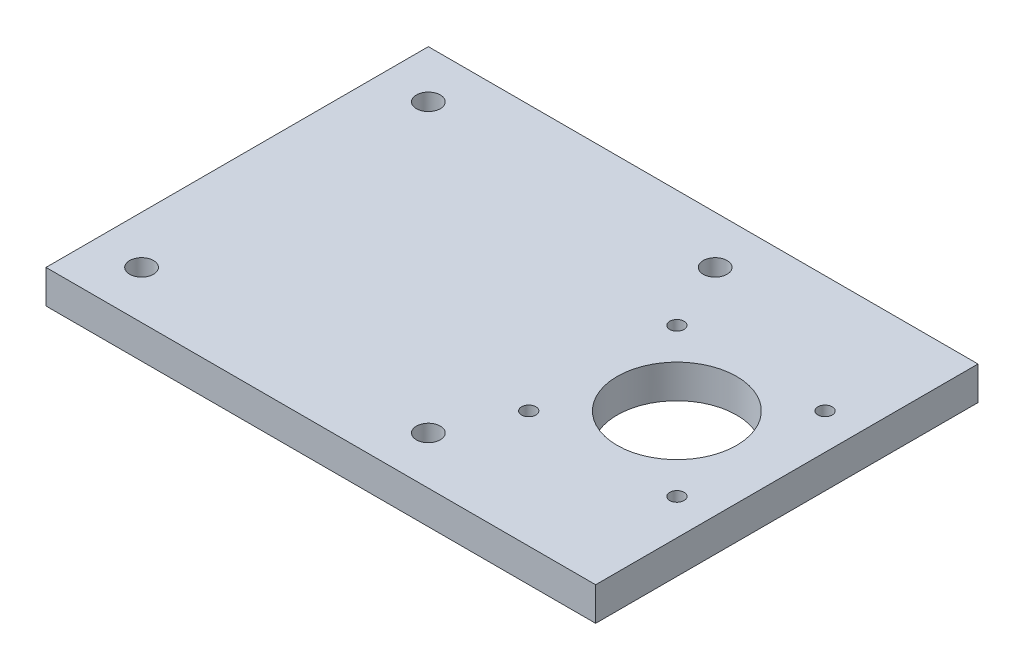
from build123d import *

# Parameters (mm, degrees)
SKETCH1_W           = 80
SKETCH1_H           = 80
BOSS_EXTRUDE1_DEPTH = 7
SKETCH2_R           = 2.5
CUT_EXTRUDE1_DEPTH  = 10
SKETCH4_W           = 80
SKETCH4_H           = 7
BOSS_EXTRUDE2_DEPTH = 35
SKETCH3_R           = 1.5
SKETCH3_R_2         = 12.5
CUT_EXTRUDE2_DEPTH  = 10


with BuildPart() as part:
    # Sketch1 → Boss-Extrude1 (new body)
    with BuildSketch(Plane(origin=(0, 0, 0), x_dir=(1, 0, 0), z_dir=(0, 1, 0))):
        with Locations((40, 40)):
            Rectangle(SKETCH1_W, SKETCH1_H)
    extrude(amount=BOSS_EXTRUDE1_DEPTH)

    # Sketch2 → Cut-Extrude1 (cut)
    with BuildSketch(Plane.XZ):
        with Locations(Location((70, -70, 0), (0, 0, 270))):
            Circle(SKETCH2_R)
        with Locations(Location((70, -10, 0), (0, 0, 270))):
            Circle(SKETCH2_R)
        with Locations(Location((10, -10, 0), (0, 0, 270))):
            Circle(SKETCH2_R)
        with Locations(Location((10, -70, 0), (0, 0, 270))):
            Circle(SKETCH2_R)
    extrude(amount=-CUT_EXTRUDE1_DEPTH, mode=Mode.SUBTRACT)

    # Sketch4 → Boss-Extrude2 (add)
    with BuildSketch(Plane(origin=(80, 0, 0), x_dir=(0, 0, -1), z_dir=(1, 0, 0))):
        with Locations((40, 3.5)):
            Rectangle(SKETCH4_W, SKETCH4_H)
    extrude(amount=BOSS_EXTRUDE2_DEPTH)

    # Sketch3 → Cut-Extrude2 (cut)
    with BuildSketch(Plane.XZ):
        with Locations(Location((107.5, -24.5, 0), (0, 0, 270))):
            Circle(SKETCH3_R)
        with Locations(Location((107.5, -55.5, 0), (0, 0, 270))):
            Circle(SKETCH3_R)
        with Locations(Location((76.5, -55.5, 0), (0, 0, 270))):
            Circle(SKETCH3_R)
        with Locations(Location((76.5, -24.5, 0), (0, 0, 270))):
            Circle(SKETCH3_R)
        with Locations(Location((92, -40, 0), (0, 0, 270))):
            Circle(SKETCH3_R_2)
    extrude(amount=-CUT_EXTRUDE2_DEPTH, mode=Mode.SUBTRACT)


solid = part.part
